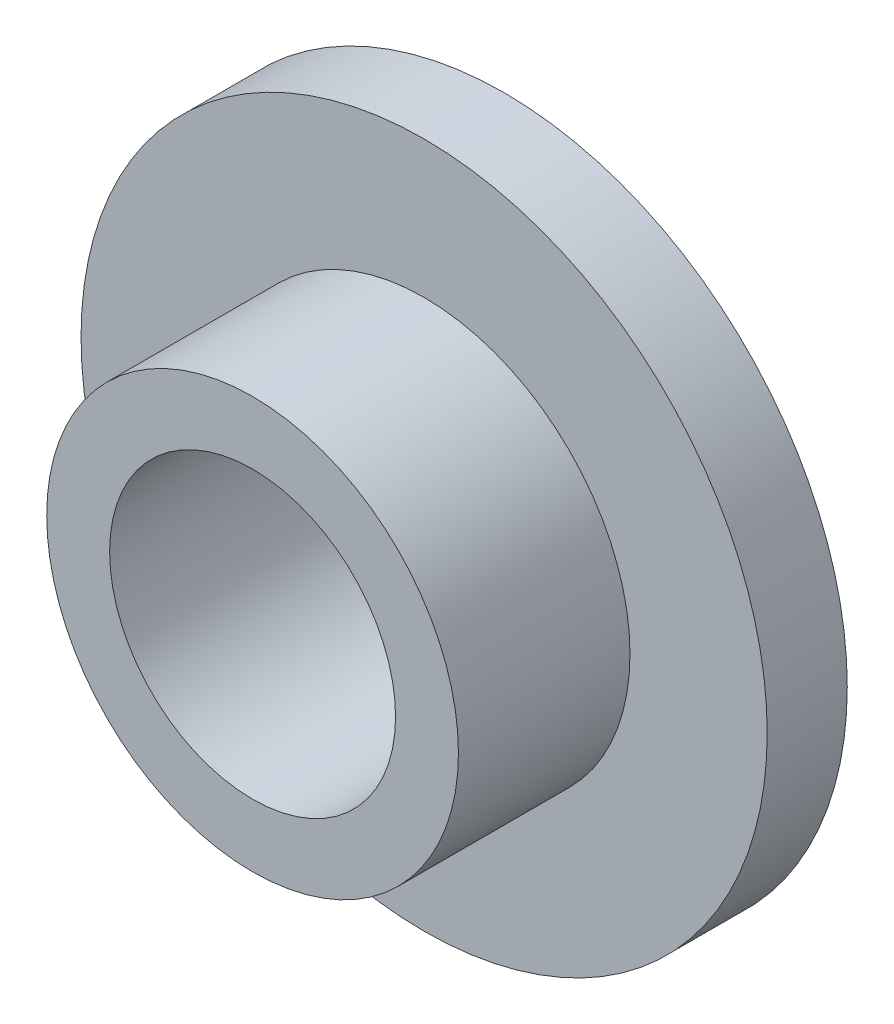
from build123d import *

# Parameters (mm, degrees)
SKETCH_1_R      = 30
SKETCH_1_R_2    = 12.5
EXTRUDE_1_DEPTH = 7
SKETCH_3_R      = 18
SKETCH_3_R_2    = 12.5
EXTRUDE_2_DEPTH = 15


with BuildPart() as part:
    # Эскиз1 → Вытянуть1 (new body)
    with BuildSketch(Plane.XY):
        Circle(SKETCH_1_R)
        Circle(SKETCH_1_R_2, mode=Mode.SUBTRACT)
    extrude(amount=EXTRUDE_1_DEPTH)

    # Эскиз3 → Вытянуть2 (add)
    with BuildSketch(Plane.XY.offset(7)):
        Circle(SKETCH_3_R)
        Circle(SKETCH_3_R_2, mode=Mode.SUBTRACT)
    extrude(amount=EXTRUDE_2_DEPTH)


solid = part.part
